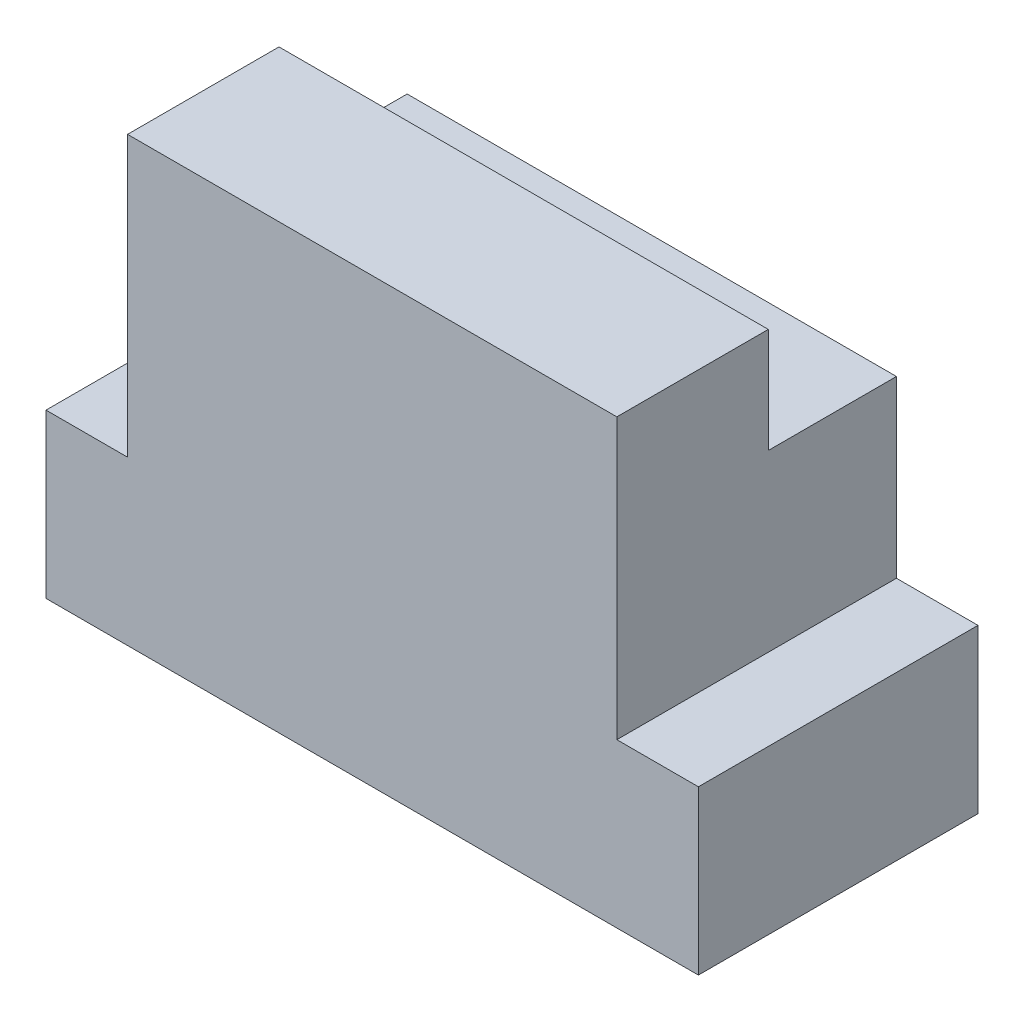
from build123d import *

# Parameters (mm, degrees)
SKETCH1_W           = 56
SKETCH1_H           = 24
BOSS_EXTRUDE1_DEPTH = 14
SKETCH5_W           = 42
SKETCH5_H           = 13
BOSS_EXTRUDE4_DEPTH = 24
SKETCH6_W           = 42
SKETCH6_H           = 11
BOSS_EXTRUDE5_DEPTH = 15


with BuildPart() as part:
    # Sketch1 → Boss-Extrude1 (new body)
    with BuildSketch(Plane(origin=(0, 0, 0), x_dir=(1, 0, 0), z_dir=(0, 1, 0))):
        Rectangle(SKETCH1_W, SKETCH1_H)
    extrude(amount=BOSS_EXTRUDE1_DEPTH)

    # Sketch5 → Boss-Extrude4 (add)
    with BuildSketch(Plane(origin=(0, 14, 0), x_dir=(1, 0, 0), z_dir=(0, 1, 0))):
        with Locations((0, -5.5)):
            Rectangle(SKETCH5_W, SKETCH5_H)
    extrude(amount=BOSS_EXTRUDE4_DEPTH)

    # Sketch6 → Boss-Extrude5 (add)
    with BuildSketch(Plane(origin=(0, 14, 0), x_dir=(1, 0, 0), z_dir=(0, 1, 0))):
        with Locations((0, 6.5)):
            Rectangle(SKETCH6_W, SKETCH6_H)
    extrude(amount=BOSS_EXTRUDE5_DEPTH)


solid = part.part
